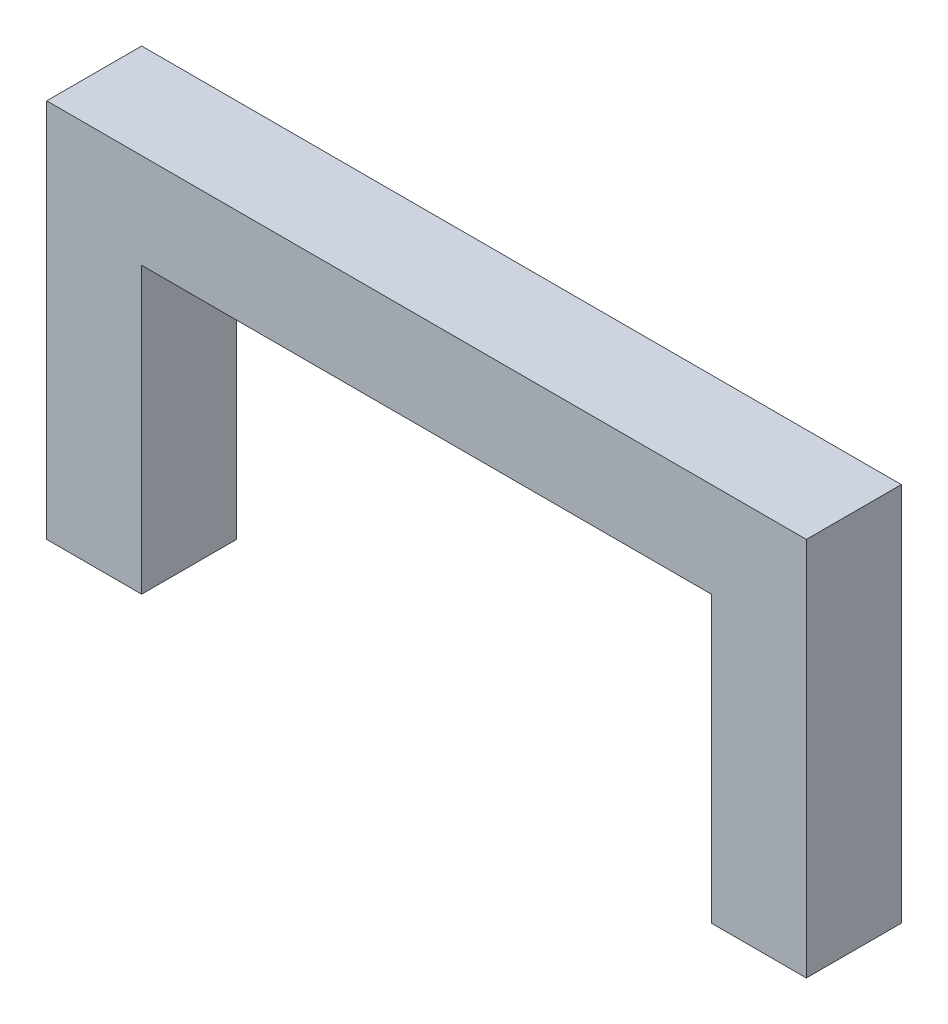
from build123d import *

# Parameters (mm, degrees)
BOSS_EXTRUDE1_DEPTH = 12.7


with BuildPart() as part:
    # Sketch2 → Boss-Extrude1 (new body)
    with BuildSketch(Plane.XY):
        Polygon((54.749116608, 10.815194346), (-46.850883392, 10.815194346), (-46.850883392, -39.984805654), (-34.150883392, -39.984805654), (-34.150883392, -1.884805654), (42.049116608, -1.884805654), (42.049116608, -39.984805654), (54.749116608, -39.984805654), align=None)
    extrude(amount=BOSS_EXTRUDE1_DEPTH)


solid = part.part
